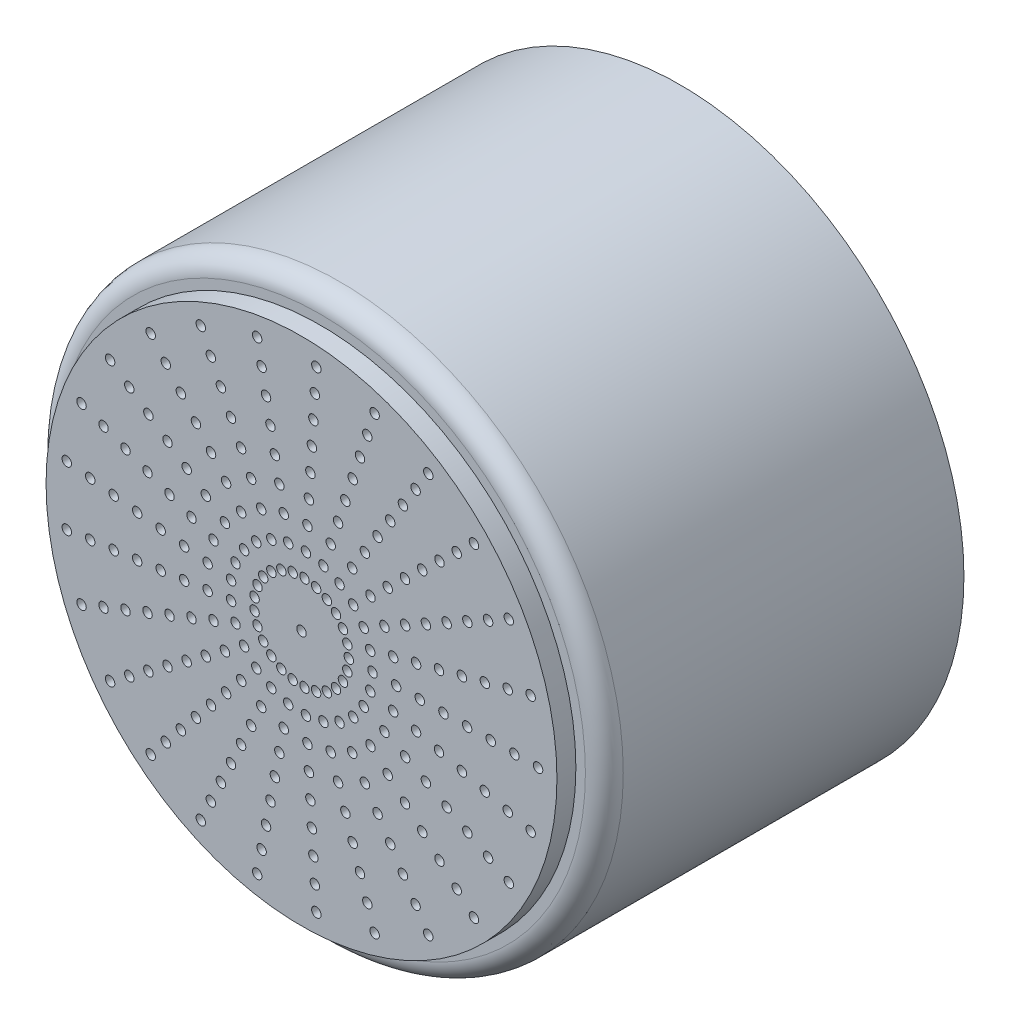
from build123d import *

# Parameters (mm, degrees)
SKIZZE1_R                       = 3
AUFSATZ_LINEAR_AUSTRAGEN1_DEPTH = 3.8
VERRUNDUNG1_R                   = 0.2
SKIZZE2_R                       = 2.699320853
AUFSATZ_LINEAR_AUSTRAGEN2_DEPTH = 0.2
SKIZZE3_R                       = 0.05
SCHNITT_LINEAR_AUSTRAGEN1_DEPTH = 3


with BuildPart() as part:
    # Skizze1 → Aufsatz-Linear austragen1 (new body)
    with BuildSketch(Plane.XY):
        with Locations(Location((0, 0, 0), (0, 0, 180))):
            Circle(SKIZZE1_R)
    extrude(amount=AUFSATZ_LINEAR_AUSTRAGEN1_DEPTH)

    # Verrundung1
    verrundung1_edges = [part.edges().sort_by_distance(p)[0] for p in [
        (3, 0, 3.8),
    ]]
    fillet(verrundung1_edges, radius=VERRUNDUNG1_R)

    # Skizze2 → Aufsatz-Linear austragen2 (add)
    with BuildSketch(Plane.XY.offset(3.8)):
        Circle(SKIZZE2_R)
    extrude(amount=AUFSATZ_LINEAR_AUSTRAGEN2_DEPTH)

    # Skizze3 → Schnitt-Linear austragen1 (cut)
    with BuildSketch(Plane.XY.offset(4)):
        Circle(SKIZZE3_R)
        with Locations((0.5, 0)):
            Circle(SKIZZE3_R)
        with Locations((0.75, 0)):
            Circle(SKIZZE3_R)
        with Locations((1, 0)):
            Circle(SKIZZE3_R)
        with Locations((1.25, 0)):
            Circle(SKIZZE3_R)
        with Locations((1.5, 0)):
            Circle(SKIZZE3_R)
        with Locations((1.75, 0)):
            Circle(SKIZZE3_R)
        with Locations((2, 0)):
            Circle(SKIZZE3_R)
        with Locations((2.25, 0)):
            Circle(SKIZZE3_R)
        with Locations((2.5, 0)):
            Circle(SKIZZE3_R)
        with Locations((0.484291581, -0.124344944)):
            Circle(SKIZZE3_R)
        with Locations((0.726437371, -0.186517415)):
            Circle(SKIZZE3_R)
        with Locations((0.968583161, -0.248689887)):
            Circle(SKIZZE3_R)
        with Locations((1.210728951, -0.310862359)):
            Circle(SKIZZE3_R)
        with Locations((1.452874742, -0.373034831)):
            Circle(SKIZZE3_R)
        with Locations((1.695020532, -0.435207303)):
            Circle(SKIZZE3_R)
        with Locations((1.937166322, -0.497379774)):
            Circle(SKIZZE3_R)
        with Locations((2.179312113, -0.559552246)):
            Circle(SKIZZE3_R)
        with Locations((2.421457903, -0.621724718)):
            Circle(SKIZZE3_R)
        with Locations((0.43815334, -0.240876837)):
            Circle(SKIZZE3_R)
        with Locations((0.65723001, -0.361315256)):
            Circle(SKIZZE3_R)
        with Locations((0.87630668, -0.481753674)):
            Circle(SKIZZE3_R)
        with Locations((1.09538335, -0.602192093)):
            Circle(SKIZZE3_R)
        with Locations((1.31446002, -0.722630511)):
            Circle(SKIZZE3_R)
        with Locations((1.53353669, -0.84306893)):
            Circle(SKIZZE3_R)
        with Locations((1.75261336, -0.963507348)):
            Circle(SKIZZE3_R)
        with Locations((1.97169003, -1.083945767)):
            Circle(SKIZZE3_R)
        with Locations((2.1907667, -1.204384185)):
            Circle(SKIZZE3_R)
        with Locations((0.364484314, -0.342273553)):
            Circle(SKIZZE3_R)
        with Locations((0.546726471, -0.513410329)):
            Circle(SKIZZE3_R)
        with Locations((0.728968627, -0.684547106)):
            Circle(SKIZZE3_R)
        with Locations((0.911210784, -0.855683882)):
            Circle(SKIZZE3_R)
        with Locations((1.093452941, -1.026820659)):
            Circle(SKIZZE3_R)
        with Locations((1.275695098, -1.197957435)):
            Circle(SKIZZE3_R)
        with Locations((1.457937255, -1.369094212)):
            Circle(SKIZZE3_R)
        with Locations((1.640179412, -1.540230988)):
            Circle(SKIZZE3_R)
        with Locations((1.822421569, -1.711367765)):
            Circle(SKIZZE3_R)
        with Locations((0.267913397, -0.422163963)):
            Circle(SKIZZE3_R)
        with Locations((0.401870096, -0.633245944)):
            Circle(SKIZZE3_R)
        with Locations((0.535826795, -0.844327926)):
            Circle(SKIZZE3_R)
        with Locations((0.669783494, -1.055409907)):
            Circle(SKIZZE3_R)
        with Locations((0.803740192, -1.266491888)):
            Circle(SKIZZE3_R)
        with Locations((0.937696891, -1.47757387)):
            Circle(SKIZZE3_R)
        with Locations((1.07165359, -1.688655851)):
            Circle(SKIZZE3_R)
        with Locations((1.205610289, -1.899737832)):
            Circle(SKIZZE3_R)
        with Locations((1.339566987, -2.110819814)):
            Circle(SKIZZE3_R)
        with Locations((0.154508497, -0.475528258)):
            Circle(SKIZZE3_R)
        with Locations((0.231762746, -0.713292387)):
            Circle(SKIZZE3_R)
        with Locations((0.309016994, -0.951056516)):
            Circle(SKIZZE3_R)
        with Locations((0.386271243, -1.188820645)):
            Circle(SKIZZE3_R)
        with Locations((0.463525492, -1.426584774)):
            Circle(SKIZZE3_R)
        with Locations((0.54077974, -1.664348904)):
            Circle(SKIZZE3_R)
        with Locations((0.618033989, -1.902113033)):
            Circle(SKIZZE3_R)
        with Locations((0.695288237, -2.139877162)):
            Circle(SKIZZE3_R)
        with Locations((0.772542486, -2.377641291)):
            Circle(SKIZZE3_R)
        with Locations((0.03139526, -0.499013364)):
            Circle(SKIZZE3_R)
        with Locations((0.04709289, -0.748520046)):
            Circle(SKIZZE3_R)
        with Locations((0.06279052, -0.998026728)):
            Circle(SKIZZE3_R)
        with Locations((0.078488149, -1.247533411)):
            Circle(SKIZZE3_R)
        with Locations((0.094185779, -1.497040093)):
            Circle(SKIZZE3_R)
        with Locations((0.109883409, -1.746546775)):
            Circle(SKIZZE3_R)
        with Locations((0.125581039, -1.996053457)):
            Circle(SKIZZE3_R)
        with Locations((0.141278669, -2.245560139)):
            Circle(SKIZZE3_R)
        with Locations((0.156976299, -2.495066821)):
            Circle(SKIZZE3_R)
        with Locations((-0.093690657, -0.491143625)):
            Circle(SKIZZE3_R)
        with Locations((-0.140535986, -0.736715438)):
            Circle(SKIZZE3_R)
        with Locations((-0.187381315, -0.982287251)):
            Circle(SKIZZE3_R)
        with Locations((-0.234226643, -1.227859063)):
            Circle(SKIZZE3_R)
        with Locations((-0.281071972, -1.473430876)):
            Circle(SKIZZE3_R)
        with Locations((-0.327917301, -1.719002689)):
            Circle(SKIZZE3_R)
        with Locations((-0.374762629, -1.964574501)):
            Circle(SKIZZE3_R)
        with Locations((-0.421607958, -2.210146314)):
            Circle(SKIZZE3_R)
        with Locations((-0.468453286, -2.455718127)):
            Circle(SKIZZE3_R)
        with Locations((-0.212889646, -0.452413526)):
            Circle(SKIZZE3_R)
        with Locations((-0.319334469, -0.678620289)):
            Circle(SKIZZE3_R)
        with Locations((-0.425779292, -0.904827052)):
            Circle(SKIZZE3_R)
        with Locations((-0.532224114, -1.131033816)):
            Circle(SKIZZE3_R)
        with Locations((-0.638668937, -1.357240579)):
            Circle(SKIZZE3_R)
        with Locations((-0.74511376, -1.583447342)):
            Circle(SKIZZE3_R)
        with Locations((-0.851558583, -1.809654105)):
            Circle(SKIZZE3_R)
        with Locations((-0.958003406, -2.035860868)):
            Circle(SKIZZE3_R)
        with Locations((-1.064448229, -2.262067631)):
            Circle(SKIZZE3_R)
        with Locations((-0.318711995, -0.385256621)):
            Circle(SKIZZE3_R)
        with Locations((-0.478067992, -0.577884932)):
            Circle(SKIZZE3_R)
        with Locations((-0.63742399, -0.770513243)):
            Circle(SKIZZE3_R)
        with Locations((-0.796779987, -0.963141553)):
            Circle(SKIZZE3_R)
        with Locations((-0.956135985, -1.155769864)):
            Circle(SKIZZE3_R)
        with Locations((-1.115491982, -1.348398175)):
            Circle(SKIZZE3_R)
        with Locations((-1.274847979, -1.541026486)):
            Circle(SKIZZE3_R)
        with Locations((-1.434203977, -1.733654796)):
            Circle(SKIZZE3_R)
        with Locations((-1.593559974, -1.926283107)):
            Circle(SKIZZE3_R)
        with Locations((-0.404508497, -0.293892626)):
            Circle(SKIZZE3_R)
        with Locations((-0.606762746, -0.440838939)):
            Circle(SKIZZE3_R)
        with Locations((-0.809016994, -0.587785252)):
            Circle(SKIZZE3_R)
        with Locations((-1.011271243, -0.734731565)):
            Circle(SKIZZE3_R)
        with Locations((-1.213525492, -0.881677878)):
            Circle(SKIZZE3_R)
        with Locations((-1.41577974, -1.028624192)):
            Circle(SKIZZE3_R)
        with Locations((-1.618033989, -1.175570505)):
            Circle(SKIZZE3_R)
        with Locations((-1.820288237, -1.322516818)):
            Circle(SKIZZE3_R)
        with Locations((-2.022542486, -1.469463131)):
            Circle(SKIZZE3_R)
        with Locations((-0.464888243, -0.184062276)):
            Circle(SKIZZE3_R)
        with Locations((-0.697332364, -0.276093415)):
            Circle(SKIZZE3_R)
        with Locations((-0.929776486, -0.368124553)):
            Circle(SKIZZE3_R)
        with Locations((-1.162220607, -0.460155691)):
            Circle(SKIZZE3_R)
        with Locations((-1.394664729, -0.552186829)):
            Circle(SKIZZE3_R)
        with Locations((-1.62710885, -0.644217967)):
            Circle(SKIZZE3_R)
        with Locations((-1.859552972, -0.736249105)):
            Circle(SKIZZE3_R)
        with Locations((-2.091997093, -0.828280244)):
            Circle(SKIZZE3_R)
        with Locations((-2.324441215, -0.920311382)):
            Circle(SKIZZE3_R)
        with Locations((-0.496057351, -0.062666617)):
            Circle(SKIZZE3_R)
        with Locations((-0.744086026, -0.093999925)):
            Circle(SKIZZE3_R)
        with Locations((-0.992114701, -0.125333234)):
            Circle(SKIZZE3_R)
        with Locations((-1.240143377, -0.156666542)):
            Circle(SKIZZE3_R)
        with Locations((-1.488172052, -0.18799985)):
            Circle(SKIZZE3_R)
        with Locations((-1.736200727, -0.219333159)):
            Circle(SKIZZE3_R)
        with Locations((-1.984229403, -0.250666467)):
            Circle(SKIZZE3_R)
        with Locations((-2.232258078, -0.281999776)):
            Circle(SKIZZE3_R)
        with Locations((-2.480286753, -0.313333084)):
            Circle(SKIZZE3_R)
        with Locations((-0.496057351, 0.062666617)):
            Circle(SKIZZE3_R)
        with Locations((-0.744086026, 0.093999925)):
            Circle(SKIZZE3_R)
        with Locations((-0.992114701, 0.125333234)):
            Circle(SKIZZE3_R)
        with Locations((-1.240143377, 0.156666542)):
            Circle(SKIZZE3_R)
        with Locations((-1.488172052, 0.18799985)):
            Circle(SKIZZE3_R)
        with Locations((-1.736200727, 0.219333159)):
            Circle(SKIZZE3_R)
        with Locations((-1.984229403, 0.250666467)):
            Circle(SKIZZE3_R)
        with Locations((-2.232258078, 0.281999776)):
            Circle(SKIZZE3_R)
        with Locations((-2.480286753, 0.313333084)):
            Circle(SKIZZE3_R)
        with Locations((-0.464888243, 0.184062276)):
            Circle(SKIZZE3_R)
        with Locations((-0.697332364, 0.276093415)):
            Circle(SKIZZE3_R)
        with Locations((-0.929776486, 0.368124553)):
            Circle(SKIZZE3_R)
        with Locations((-1.162220607, 0.460155691)):
            Circle(SKIZZE3_R)
        with Locations((-1.394664729, 0.552186829)):
            Circle(SKIZZE3_R)
        with Locations((-1.62710885, 0.644217967)):
            Circle(SKIZZE3_R)
        with Locations((-1.859552972, 0.736249105)):
            Circle(SKIZZE3_R)
        with Locations((-2.091997093, 0.828280244)):
            Circle(SKIZZE3_R)
        with Locations((-2.324441215, 0.920311382)):
            Circle(SKIZZE3_R)
        with Locations((-0.404508497, 0.293892626)):
            Circle(SKIZZE3_R)
        with Locations((-0.606762746, 0.440838939)):
            Circle(SKIZZE3_R)
        with Locations((-0.809016994, 0.587785252)):
            Circle(SKIZZE3_R)
        with Locations((-1.011271243, 0.734731565)):
            Circle(SKIZZE3_R)
        with Locations((-1.213525492, 0.881677878)):
            Circle(SKIZZE3_R)
        with Locations((-1.41577974, 1.028624192)):
            Circle(SKIZZE3_R)
        with Locations((-1.618033989, 1.175570505)):
            Circle(SKIZZE3_R)
        with Locations((-1.820288237, 1.322516818)):
            Circle(SKIZZE3_R)
        with Locations((-2.022542486, 1.469463131)):
            Circle(SKIZZE3_R)
        with Locations((-0.318711995, 0.385256621)):
            Circle(SKIZZE3_R)
        with Locations((-0.478067992, 0.577884932)):
            Circle(SKIZZE3_R)
        with Locations((-0.63742399, 0.770513243)):
            Circle(SKIZZE3_R)
        with Locations((-0.796779987, 0.963141553)):
            Circle(SKIZZE3_R)
        with Locations((-0.956135985, 1.155769864)):
            Circle(SKIZZE3_R)
        with Locations((-1.115491982, 1.348398175)):
            Circle(SKIZZE3_R)
        with Locations((-1.274847979, 1.541026486)):
            Circle(SKIZZE3_R)
        with Locations((-1.434203977, 1.733654796)):
            Circle(SKIZZE3_R)
        with Locations((-1.593559974, 1.926283107)):
            Circle(SKIZZE3_R)
        with Locations((-0.212889646, 0.452413526)):
            Circle(SKIZZE3_R)
        with Locations((-0.319334469, 0.678620289)):
            Circle(SKIZZE3_R)
        with Locations((-0.425779292, 0.904827052)):
            Circle(SKIZZE3_R)
        with Locations((-0.532224114, 1.131033816)):
            Circle(SKIZZE3_R)
        with Locations((-0.638668937, 1.357240579)):
            Circle(SKIZZE3_R)
        with Locations((-0.74511376, 1.583447342)):
            Circle(SKIZZE3_R)
        with Locations((-0.851558583, 1.809654105)):
            Circle(SKIZZE3_R)
        with Locations((-0.958003406, 2.035860868)):
            Circle(SKIZZE3_R)
        with Locations((-1.064448229, 2.262067631)):
            Circle(SKIZZE3_R)
        with Locations((-0.093690657, 0.491143625)):
            Circle(SKIZZE3_R)
        with Locations((-0.140535986, 0.736715438)):
            Circle(SKIZZE3_R)
        with Locations((-0.187381315, 0.982287251)):
            Circle(SKIZZE3_R)
        with Locations((-0.234226643, 1.227859063)):
            Circle(SKIZZE3_R)
        with Locations((-0.281071972, 1.473430876)):
            Circle(SKIZZE3_R)
        with Locations((-0.327917301, 1.719002689)):
            Circle(SKIZZE3_R)
        with Locations((-0.374762629, 1.964574501)):
            Circle(SKIZZE3_R)
        with Locations((-0.421607958, 2.210146314)):
            Circle(SKIZZE3_R)
        with Locations((-0.468453286, 2.455718127)):
            Circle(SKIZZE3_R)
        with Locations((0.03139526, 0.499013364)):
            Circle(SKIZZE3_R)
        with Locations((0.04709289, 0.748520046)):
            Circle(SKIZZE3_R)
        with Locations((0.06279052, 0.998026728)):
            Circle(SKIZZE3_R)
        with Locations((0.078488149, 1.247533411)):
            Circle(SKIZZE3_R)
        with Locations((0.094185779, 1.497040093)):
            Circle(SKIZZE3_R)
        with Locations((0.109883409, 1.746546775)):
            Circle(SKIZZE3_R)
        with Locations((0.125581039, 1.996053457)):
            Circle(SKIZZE3_R)
        with Locations((0.141278669, 2.245560139)):
            Circle(SKIZZE3_R)
        with Locations((0.156976299, 2.495066821)):
            Circle(SKIZZE3_R)
        with Locations((0.154508497, 0.475528258)):
            Circle(SKIZZE3_R)
        with Locations((0.231762746, 0.713292387)):
            Circle(SKIZZE3_R)
        with Locations((0.309016994, 0.951056516)):
            Circle(SKIZZE3_R)
        with Locations((0.386271243, 1.188820645)):
            Circle(SKIZZE3_R)
        with Locations((0.463525492, 1.426584774)):
            Circle(SKIZZE3_R)
        with Locations((0.54077974, 1.664348904)):
            Circle(SKIZZE3_R)
        with Locations((0.618033989, 1.902113033)):
            Circle(SKIZZE3_R)
        with Locations((0.695288237, 2.139877162)):
            Circle(SKIZZE3_R)
        with Locations((0.772542486, 2.377641291)):
            Circle(SKIZZE3_R)
        with Locations((0.267913397, 0.422163963)):
            Circle(SKIZZE3_R)
        with Locations((0.401870096, 0.633245944)):
            Circle(SKIZZE3_R)
        with Locations((0.535826795, 0.844327926)):
            Circle(SKIZZE3_R)
        with Locations((0.669783494, 1.055409907)):
            Circle(SKIZZE3_R)
        with Locations((0.803740192, 1.266491888)):
            Circle(SKIZZE3_R)
        with Locations((0.937696891, 1.47757387)):
            Circle(SKIZZE3_R)
        with Locations((1.07165359, 1.688655851)):
            Circle(SKIZZE3_R)
        with Locations((1.205610289, 1.899737832)):
            Circle(SKIZZE3_R)
        with Locations((1.339566987, 2.110819814)):
            Circle(SKIZZE3_R)
        with Locations((0.364484314, 0.342273553)):
            Circle(SKIZZE3_R)
        with Locations((0.546726471, 0.513410329)):
            Circle(SKIZZE3_R)
        with Locations((0.728968627, 0.684547106)):
            Circle(SKIZZE3_R)
        with Locations((0.911210784, 0.855683882)):
            Circle(SKIZZE3_R)
        with Locations((1.093452941, 1.026820659)):
            Circle(SKIZZE3_R)
        with Locations((1.275695098, 1.197957435)):
            Circle(SKIZZE3_R)
        with Locations((1.457937255, 1.369094212)):
            Circle(SKIZZE3_R)
        with Locations((1.640179412, 1.540230988)):
            Circle(SKIZZE3_R)
        with Locations((1.822421569, 1.711367765)):
            Circle(SKIZZE3_R)
        with Locations((0.43815334, 0.240876837)):
            Circle(SKIZZE3_R)
        with Locations((0.65723001, 0.361315256)):
            Circle(SKIZZE3_R)
        with Locations((0.87630668, 0.481753674)):
            Circle(SKIZZE3_R)
        with Locations((1.09538335, 0.602192093)):
            Circle(SKIZZE3_R)
        with Locations((1.31446002, 0.722630511)):
            Circle(SKIZZE3_R)
        with Locations((1.53353669, 0.84306893)):
            Circle(SKIZZE3_R)
        with Locations((1.75261336, 0.963507348)):
            Circle(SKIZZE3_R)
        with Locations((1.97169003, 1.083945767)):
            Circle(SKIZZE3_R)
        with Locations((2.1907667, 1.204384185)):
            Circle(SKIZZE3_R)
        with Locations((0.484291581, 0.124344944)):
            Circle(SKIZZE3_R)
        with Locations((0.726437371, 0.186517415)):
            Circle(SKIZZE3_R)
        with Locations((0.968583161, 0.248689887)):
            Circle(SKIZZE3_R)
        with Locations((1.210728951, 0.310862359)):
            Circle(SKIZZE3_R)
        with Locations((1.452874742, 0.373034831)):
            Circle(SKIZZE3_R)
        with Locations((1.695020532, 0.435207303)):
            Circle(SKIZZE3_R)
        with Locations((1.937166322, 0.497379774)):
            Circle(SKIZZE3_R)
        with Locations((2.179312113, 0.559552246)):
            Circle(SKIZZE3_R)
        with Locations((2.421457903, 0.621724718)):
            Circle(SKIZZE3_R)
    extrude(amount=-SCHNITT_LINEAR_AUSTRAGEN1_DEPTH, mode=Mode.SUBTRACT)


solid = part.part
